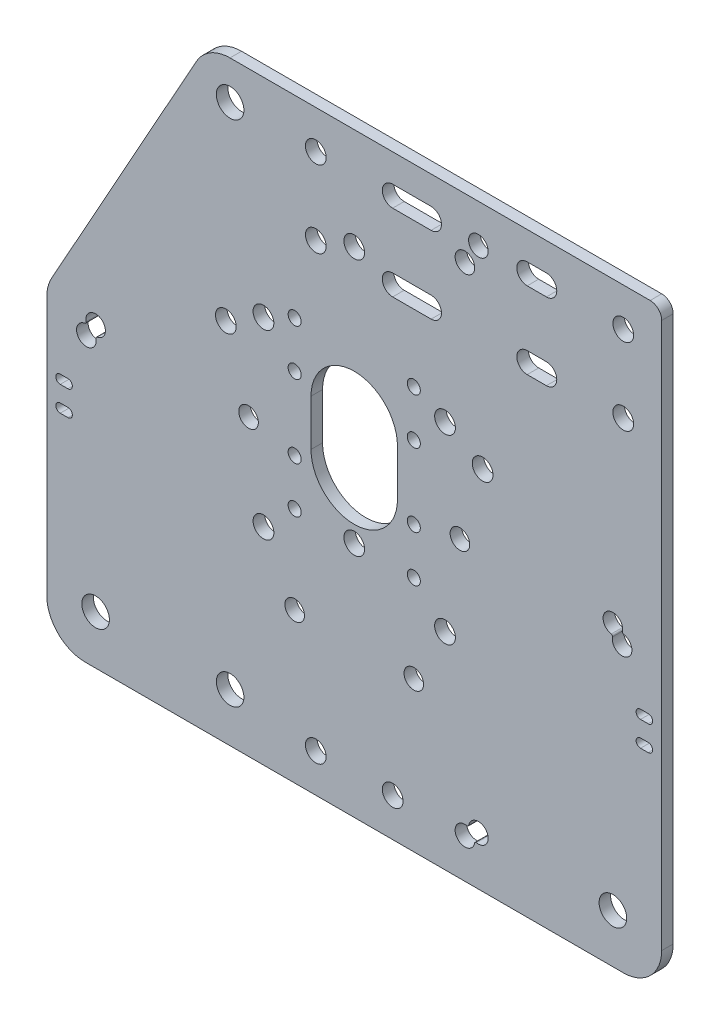
from build123d import *

# Parameters (mm, degrees)
MODEL_R                         = 3.59
MODEL_R_2                       = 2.55
MODEL_R_3                       = 1.7
MODEL_R_4                       = 2.7
AUFSATZ_LINEAR_AUSTRAGEN1_DEPTH = 3


with BuildPart() as part:
    # Model → Aufsatz-Linear austragen1 (new body)
    with BuildSketch(Plane.XY):
        with BuildLine():
            Line((157, 155), (47.6787101, 155))
            ThreePointArc((47.6787101, 155), (42.610842111, 153.620714242), (38.94098175, 149.86334281))
            Line((38.94098175, 149.86334281), (1.26227165, 82.167861266))
            ThreePointArc((1.26227165, 82.167861266), (0.32071068, 79.816760135), (0, 77.304518457))
            Line((0, 77.304518457), (0, 10))
            ThreePointArc((0, 10), (2.928932188, 2.928932188), (10, 0))
            Line((10, 0), (150, 0))
            ThreePointArc((150, 0), (157.071067812, 2.928932188), (160, 10))
            Line((160, 10), (160, 152))
            ThreePointArc((160, 152), (159.121320344, 154.121320344), (157, 155))
        make_face()
        with Locations((12.7, 12.7)):
            Circle(MODEL_R, mode=Mode.SUBTRACT)
        with Locations((47.7, 12.7)):
            Circle(MODEL_R, mode=Mode.SUBTRACT)
        with Locations((147.3, 12.7)):
            Circle(MODEL_R, mode=Mode.SUBTRACT)
        with Locations((47.7, 145)):
            Circle(MODEL_R, mode=Mode.SUBTRACT)
        with Locations((112.3, 145)):
            Circle(MODEL_R_2, mode=Mode.SUBTRACT)
        with Locations((52.5, 76.5)):
            Circle(MODEL_R_2, mode=Mode.SUBTRACT)
        with Locations((107.5, 76.5)):
            Circle(MODEL_R_2, mode=Mode.SUBTRACT)
        with Locations((64.5, 39)):
            Circle(MODEL_R_2, mode=Mode.SUBTRACT)
        with Locations((95.5, 39)):
            Circle(MODEL_R_2, mode=Mode.SUBTRACT)
        with Locations((64.5, 61.8)):
            Circle(MODEL_R_3, mode=Mode.SUBTRACT)
        with Locations((64.5, 73.8)):
            Circle(MODEL_R_3, mode=Mode.SUBTRACT)
        with Locations((64.5, 92.8)):
            Circle(MODEL_R_3, mode=Mode.SUBTRACT)
        with Locations((64.5, 104.8)):
            Circle(MODEL_R_3, mode=Mode.SUBTRACT)
        with Locations((95.5, 61.8)):
            Circle(MODEL_R_3, mode=Mode.SUBTRACT)
        with Locations((95.5, 73.8)):
            Circle(MODEL_R_3, mode=Mode.SUBTRACT)
        with Locations((95.5, 92.8)):
            Circle(MODEL_R_3, mode=Mode.SUBTRACT)
        with Locations((95.5, 104.8)):
            Circle(MODEL_R_3, mode=Mode.SUBTRACT)
        with Locations((56.38, 53.68)):
            Circle(MODEL_R_4, mode=Mode.SUBTRACT)
        with Locations((103.62, 53.68)):
            Circle(MODEL_R_4, mode=Mode.SUBTRACT)
        with Locations((103.62, 100.92)):
            Circle(MODEL_R_4, mode=Mode.SUBTRACT)
        with Locations((56.38, 100.92)):
            Circle(MODEL_R_4, mode=Mode.SUBTRACT)
        with Locations((70, 145)):
            Circle(MODEL_R_4, mode=Mode.SUBTRACT)
        with Locations((150, 145)):
            Circle(MODEL_R_4, mode=Mode.SUBTRACT)
        with Locations((150, 125)):
            Circle(MODEL_R_4, mode=Mode.SUBTRACT)
        with Locations((108.8, 139.5)):
            Circle(MODEL_R_2, mode=Mode.SUBTRACT)
        with Locations((80, 61.8)):
            Circle(MODEL_R_4, mode=Mode.SUBTRACT)
        with Locations((113.403724343, 95.203724343)):
            Circle(MODEL_R_4, mode=Mode.SUBTRACT)
        with Locations((80, 128.607448687)):
            Circle(MODEL_R_4, mode=Mode.SUBTRACT)
        with Locations((46.596275657, 95.203724343)):
            Circle(MODEL_R_4, mode=Mode.SUBTRACT)
        with Locations((90, 10)):
            Circle(MODEL_R_4, mode=Mode.SUBTRACT)
        with Locations((70, 10)):
            Circle(MODEL_R_4, mode=Mode.SUBTRACT)
        with Locations((69.999999708, 125.000000186)):
            Circle(MODEL_R_4, mode=Mode.SUBTRACT)
        with BuildLine():
            Line((68.75, 89.3), (68.75, 77.3))
            ThreePointArc((68.75, 77.3), (80, 66.05), (91.25, 77.3))
            Line((91.25, 77.3), (91.25, 89.3))
            ThreePointArc((91.25, 89.3), (80, 100.55), (68.75, 89.3))
        make_face(mode=Mode.SUBTRACT)
        with BuildLine():
            Line((130, 147.7), (125, 147.7))
            ThreePointArc((125, 147.7), (122.3, 145), (125, 142.3))
            Line((125, 142.3), (130, 142.3))
            ThreePointArc((130, 142.3), (132.7, 145), (130, 147.7))
        make_face(mode=Mode.SUBTRACT)
        with BuildLine():
            Line((129.999999456, 127.699999985), (124.999999456, 127.699999985))
            ThreePointArc((124.999999456, 127.699999985), (122.299999456, 124.999999985), (124.999999456, 122.299999985))
            Line((124.999999456, 122.299999985), (129.999999456, 122.299999985))
            ThreePointArc((129.999999456, 122.299999985), (132.699999456, 124.999999985), (129.999999456, 127.699999985))
        make_face(mode=Mode.SUBTRACT)
        with BuildLine():
            Line((99.999999456, 127.699999985), (89.999999456, 127.699999985))
            ThreePointArc((89.999999456, 127.699999985), (87.299999456, 124.999999985), (89.999999456, 122.299999985))
            Line((89.999999456, 122.299999985), (99.999999456, 122.299999985))
            ThreePointArc((99.999999456, 122.299999985), (102.699999456, 124.999999985), (99.999999456, 127.699999985))
        make_face(mode=Mode.SUBTRACT)
        with BuildLine():
            Line((99.999999587, 147.700000259), (89.999999587, 147.700000259))
            ThreePointArc((89.999999587, 147.700000259), (87.299999587, 145.000000259), (89.999999587, 142.300000259))
            Line((89.999999587, 142.300000259), (99.999999587, 142.300000259))
            ThreePointArc((99.999999587, 142.300000259), (102.699999587, 145.000000259), (99.999999587, 147.700000259))
        make_face(mode=Mode.SUBTRACT)
        with BuildLine():
            Line((5.5, 55.15), (3.5, 55.15))
            ThreePointArc((3.5, 55.15), (2.35, 54), (3.5, 52.85))
            Line((3.5, 52.85), (5.5, 52.85))
            ThreePointArc((5.5, 52.85), (6.65, 54), (5.5, 55.15))
        make_face(mode=Mode.SUBTRACT)
        with BuildLine():
            Line((5.5, 61.65), (3.5, 61.65))
            ThreePointArc((3.5, 61.65), (2.35, 60.5), (3.5, 59.35))
            Line((3.5, 59.35), (5.5, 59.35))
            ThreePointArc((5.5, 59.35), (6.65, 60.5), (5.5, 61.65))
        make_face(mode=Mode.SUBTRACT)
        with BuildLine():
            Line((156.5, 55.15), (154.5, 55.15))
            ThreePointArc((154.5, 55.15), (153.35, 54), (154.5, 52.85))
            Line((154.5, 52.85), (156.5, 52.85))
            ThreePointArc((156.5, 52.85), (157.65, 54), (156.5, 55.15))
        make_face(mode=Mode.SUBTRACT)
        with BuildLine():
            Line((156.5, 61.65), (154.5, 61.65))
            ThreePointArc((154.5, 61.65), (153.35, 60.5), (154.5, 59.35))
            Line((154.5, 59.35), (156.5, 59.35))
            ThreePointArc((156.5, 59.35), (157.65, 60.5), (156.5, 61.65))
        make_face(mode=Mode.SUBTRACT)
        with BuildLine():
            ThreePointArc((109.310874569, 12.798300857), (106.696941428, 8.857902693), (111.314549159, 9.876275414))
            ThreePointArc((111.314549159, 9.876275414), (111.482776901, 10.139700353), (111.789125431, 10.201699143))
            ThreePointArc((111.789125431, 10.201699143), (114.403058572, 14.142097307), (109.785450841, 13.123724586))
            ThreePointArc((109.785450841, 13.123724586), (109.617223099, 12.860299647), (109.310874569, 12.798300857))
        make_face(mode=Mode.SUBTRACT)
        with BuildLine():
            ThreePointArc((147.201699143, 74.310874569), (151.142097307, 71.696941428), (150.123724586, 76.314549159))
            ThreePointArc((150.123724586, 76.314549159), (149.860299647, 76.482776901), (149.798300857, 76.789125431))
            ThreePointArc((149.798300857, 76.789125431), (145.857902693, 79.403058572), (146.876275414, 74.785450841))
            ThreePointArc((146.876275414, 74.785450841), (147.139700353, 74.617223099), (147.201699143, 74.310874569))
        make_face(mode=Mode.SUBTRACT)
        with BuildLine():
            ThreePointArc((13.123724586, 74.785450841), (14.142097307, 79.403058572), (10.201699143, 76.789125431))
            ThreePointArc((10.201699143, 76.789125431), (10.139700353, 76.482776901), (9.876275414, 76.314549159))
            ThreePointArc((9.876275414, 76.314549159), (8.857902693, 71.696941428), (12.798300857, 74.310874569))
            ThreePointArc((12.798300857, 74.310874569), (12.860299647, 74.617223099), (13.123724586, 74.785450841))
        make_face(mode=Mode.SUBTRACT)
    extrude(amount=AUFSATZ_LINEAR_AUSTRAGEN1_DEPTH)


solid = part.part
